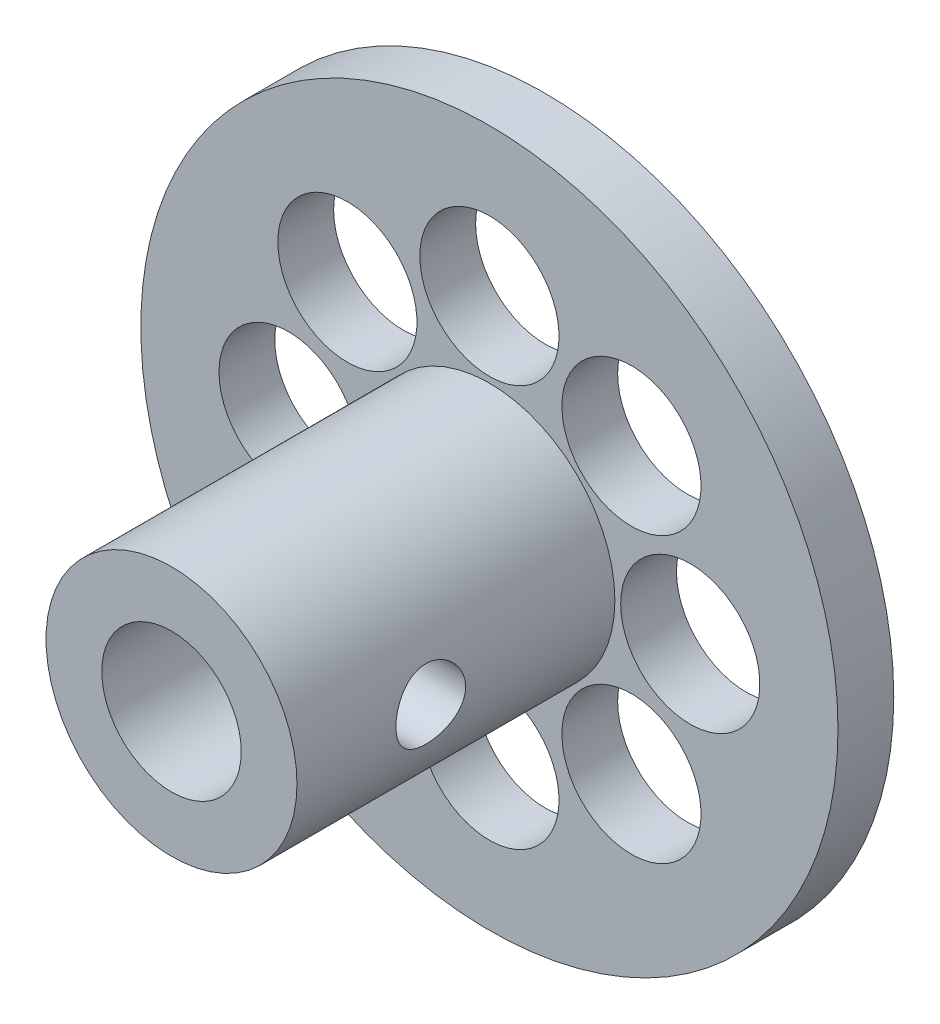
from build123d import *

# Parameters (mm, degrees)
SKETCH1_R               = 31.75
BOSS_EXTRUDE1_DEPTH     = 5.08
SKETCH2_R               = 6.35
CUT_EXTRUDE1_DEPTH      = 5.08
SKETCH3_R               = 11.43
BOSS_EXTRUDE2_DEPTH     = 28.956
CUT_EXTRUDE2_START      = -29.21
SKETCH5_R               = 6.35
CUT_EXTRUDE2_DEPTH      = 29.21
SKETCH6_R               = 6.337124867
CUT_EXTRUDE3_DEPTH      = 5.08
CUT_EXTRUDE4_DEPTH      = 17.526
CUT_EXTRUDE4_DEPTH_BACK = 11.938
SKETCH7_R               = 3.175


with BuildPart() as part:
    # Sketch1 → Boss-Extrude1 (new body)
    with BuildSketch(Plane.XY):
        Circle(SKETCH1_R)
    extrude(amount=BOSS_EXTRUDE1_DEPTH)

    # Sketch2 → Cut-Extrude1 (cut)
    with BuildSketch(Plane(origin=(0, 0, 0), x_dir=(-1, 0, 0), z_dir=(0, 0, -1))):
        Circle(SKETCH2_R)
    extrude(amount=-CUT_EXTRUDE1_DEPTH, mode=Mode.SUBTRACT)

    # Sketch3 → Boss-Extrude2 (add)
    with BuildSketch(Plane.XY.offset(5.08)):
        with Locations(Location((0, 0, 0), (0, 0, 180))):
            Circle(SKETCH3_R)
    extrude(amount=BOSS_EXTRUDE2_DEPTH)

    # Sketch5 → Cut-Extrude2 (cut)
    with BuildSketch(Plane.XY.offset(34.036).offset(CUT_EXTRUDE2_START)):
        with Locations(Location((0, 0, 0), (0, 0, 180))):
            Circle(SKETCH5_R)
    extrude(amount=CUT_EXTRUDE2_DEPTH, mode=Mode.SUBTRACT)

    # Sketch6 → Cut-Extrude3 (cut)
    with BuildSketch(Plane(origin=(0, 0, 0), x_dir=(-1, 0, 0), z_dir=(0, 0, -1))):
        with Locations((0, 18.294370769)):
            Circle(SKETCH6_R)
        with Locations((12.936073628, 12.936073628)):
            Circle(SKETCH6_R)
        with Locations((18.294370769, 0)):
            Circle(SKETCH6_R)
        with Locations((12.936073628, -12.936073628)):
            Circle(SKETCH6_R)
        with Locations((0, -18.294370769)):
            Circle(SKETCH6_R)
        with Locations((-12.936073628, -12.936073628)):
            Circle(SKETCH6_R)
        with Locations((-18.294370769, 0)):
            Circle(SKETCH6_R)
        with Locations((-12.936073628, 12.936073628)):
            Circle(SKETCH6_R)
    extrude(amount=-CUT_EXTRUDE3_DEPTH, mode=Mode.SUBTRACT)

    # Sketch7 → Cut-Extrude4 (cut, two sides: drawn at the far end of the back side and taken through both)
    with BuildSketch(Plane(origin=(0, 0, 0), x_dir=(0, 0, -1), z_dir=(1, 0, 0)).offset(-CUT_EXTRUDE4_DEPTH_BACK)):
        with Locations(Location((-21.851313678, 0, 0), (0, 0, 180))):
            Circle(SKETCH7_R)
    extrude(amount=CUT_EXTRUDE4_DEPTH + CUT_EXTRUDE4_DEPTH_BACK, mode=Mode.SUBTRACT)


solid = part.part
